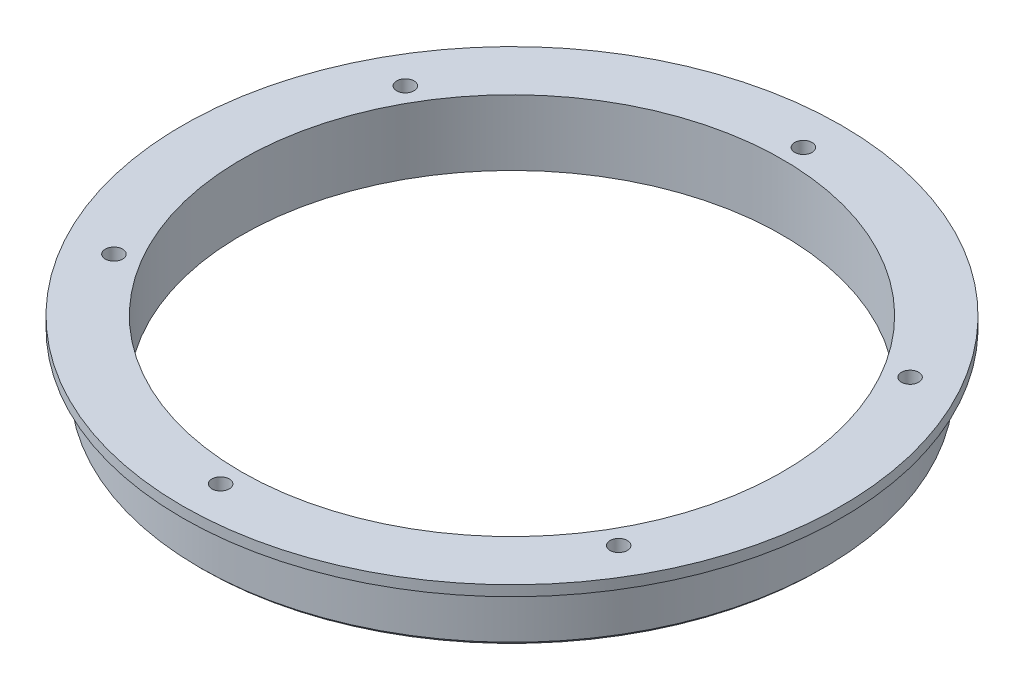
from build123d import *

# Parameters (mm, degrees)
SKETCH_1_R                   = 45
SKETCH_1_R_2                 = 39
EXTRUDE_1_DEPTH              = 3.975
SKETCH_2_R                   = 47.5
SKETCH_2_R_2                 = 39
EXTRUDE_2_DEPTH              = 1.5
HOLE_WIZARD_M3_1_D           = 2.5
HOLE_WIZARD_M3_1_CSINK_D     = 3.05
HOLE_WIZARD_M3_1_CSINK_ANGLE = 90
PATTERN_CIRCULAR_1_COUNT     = 6
CHAMFER_1_SIZE               = 0.5


with BuildPart() as part:
    # 草图1 → 凸台-拉伸1 (new, symmetric)
    with BuildSketch(Plane(origin=(0, 0, 0), x_dir=(1, 0, 0), z_dir=(0, 1, 0))):
        with Locations(Location((0, 0, 0), (0, 0, 270))):
            Circle(SKETCH_1_R)
        with Locations(Location((0, 0, 0), (0, 0, 270))):
            Circle(SKETCH_1_R_2, mode=Mode.SUBTRACT)
    extrude(amount=EXTRUDE_1_DEPTH, both=True)

    # 草图2 → 凸台-拉伸2 (add)
    with BuildSketch(Plane(origin=(0, 3.975, 0), x_dir=(1, 0, 0), z_dir=(0, 1, 0))):
        with Locations(Location((0, 0, 0), (0, 0, 270))):
            Circle(SKETCH_2_R)
        with Locations(Location((0, 0, 0), (0, 0, 270))):
            Circle(SKETCH_2_R_2, mode=Mode.SUBTRACT)
    extrude(amount=EXTRUDE_2_DEPTH)

    # M3 螺纹孔1 (through all)
    with Locations(Plane(origin=(0, -3.975, 0), x_dir=(-1, 0, 0), z_dir=(0, -1, 0))):
        with Locations((0, 42)):
            hole_wizard_m3_1 = CounterSinkHole(HOLE_WIZARD_M3_1_D / 2, HOLE_WIZARD_M3_1_CSINK_D / 2, counter_sink_angle=HOLE_WIZARD_M3_1_CSINK_ANGLE)

    # 阵列(圆周)1: M3 螺纹孔1 ×6 about axis
    pattern_circular_1_axis = Axis((0, 0, 0), (0, 1, 0))
    for i in range(1, PATTERN_CIRCULAR_1_COUNT):
        add(hole_wizard_m3_1.rotate(pattern_circular_1_axis, i * 360 / PATTERN_CIRCULAR_1_COUNT), mode=Mode.SUBTRACT)

    # 倒角1
    chamfer_1_edges = [part.edges().sort_by_distance(p)[0] for p in [
        (0, -3.975, -45),
    ]]
    chamfer(chamfer_1_edges, length=CHAMFER_1_SIZE)


solid = part.part
